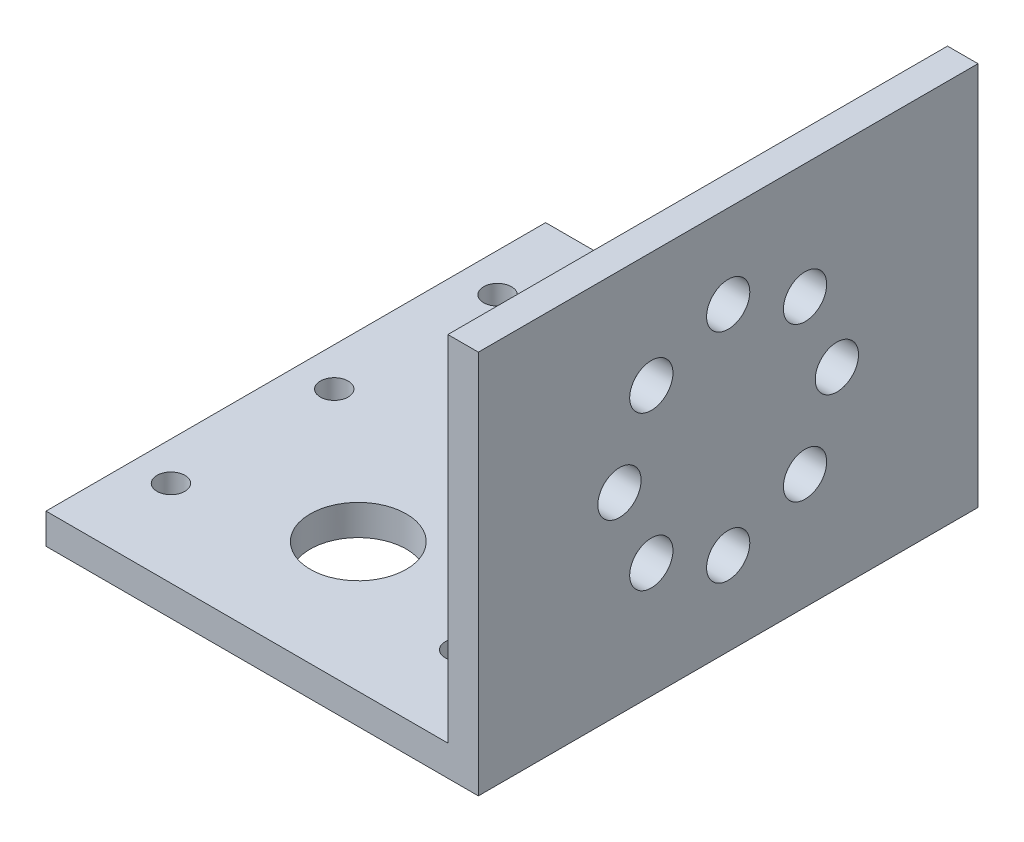
from build123d import *

# Parameters (mm, degrees)
BOSS_EXTRUDE1_DEPTH    = 52
SKETCH3_R              = 5
CUT_EXTRUDE2_DEPTH     = 78.803153053
M2_5_CLEARANCE_HOLE1_D = 2.9
M4_CLEARANCE_HOLE1_D   = 4.5


with BuildPart() as part:
    # Sketch1 → Boss-Extrude1 (new body)
    with BuildSketch(Plane.XY):
        Polygon((0, 0), (0, 36.825), (3.175, 36.825), (3.175, -3.175), (-41.825, -3.175), (-41.825, 0), align=None)
    extrude(amount=BOSS_EXTRUDE1_DEPTH)

    # Sketch3 → Cut-Extrude2 (cut, through all)
    with BuildSketch(Plane(origin=(0, -3.175, 0), x_dir=(-1, 0, 0), z_dir=(0, -1, 0))):
        with Locations(Location((22.825, -38.5, 0), (0, 0, 180))):
            Circle(SKETCH3_R)
    extrude(amount=-CUT_EXTRUDE2_DEPTH, mode=Mode.SUBTRACT)

    # M2.5 Clearance Hole1 (through all)
    with Locations(Plane(origin=(0, -3.175, 0), x_dir=(-1, 0, 0), z_dir=(0, -1, 0))):
        with Locations((7.825, -9), (37.825, -9), (7.825, -26), (37.825, -26), (37.825, -43), (7.825, -43)):
            Hole(M2_5_CLEARANCE_HOLE1_D / 2)

    # M4 Clearance Hole1 (through all)
    with Locations(Plane(origin=(3.175, 0, 0), x_dir=(0, 0, -1), z_dir=(1, 0, 0))):
        with Locations((-26, 28.138708499), (-18, 24.825), (-14.686291501, 16.825), (-18, 8.825), (-26, 5.511291501), (-34, 8.825), (-37.313708499, 16.825), (-34, 24.825)):
            Hole(M4_CLEARANCE_HOLE1_D / 2)


solid = part.part
